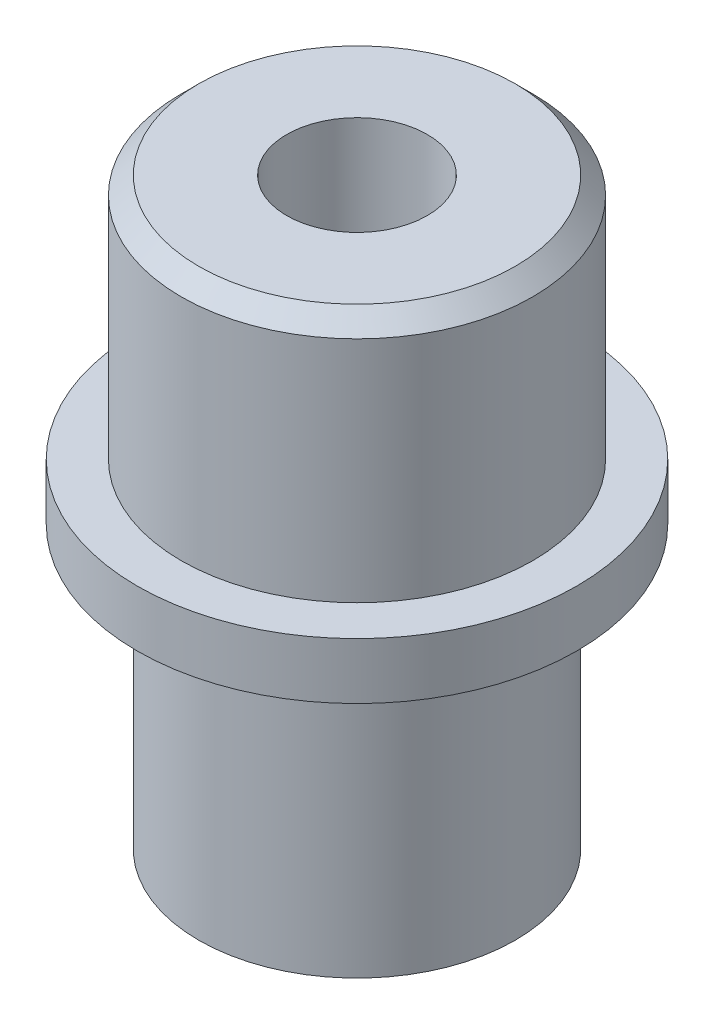
from build123d import *

# Parameters (mm, degrees)
CHAMFER1_SIZE = 0.635


with BuildPart() as part:
    # Sketch1 → Revolve1 (revolve)
    with BuildSketch(Plane.XY):
        Polygon((-2.54, 13.048802817), (-6.35, 13.048802817), (-6.35, 4.158802817), (-7.9375, 4.158802817), (-7.9375, 2.126802817), (-5.715, 2.126802817), (-5.715, -8.033197183), (0, -8.033197183), (0, 7.968802817), (-2.54, 7.968802817), align=None)
    revolve(axis=Axis((0, 0, 0), (0, 1, 0)))

    # Chamfer1
    chamfer1_edges = [part.edges().sort_by_distance(p)[0] for p in [
        (6.35, 13.048802817, 0),
    ]]
    chamfer(chamfer1_edges, length=CHAMFER1_SIZE)


solid = part.part
